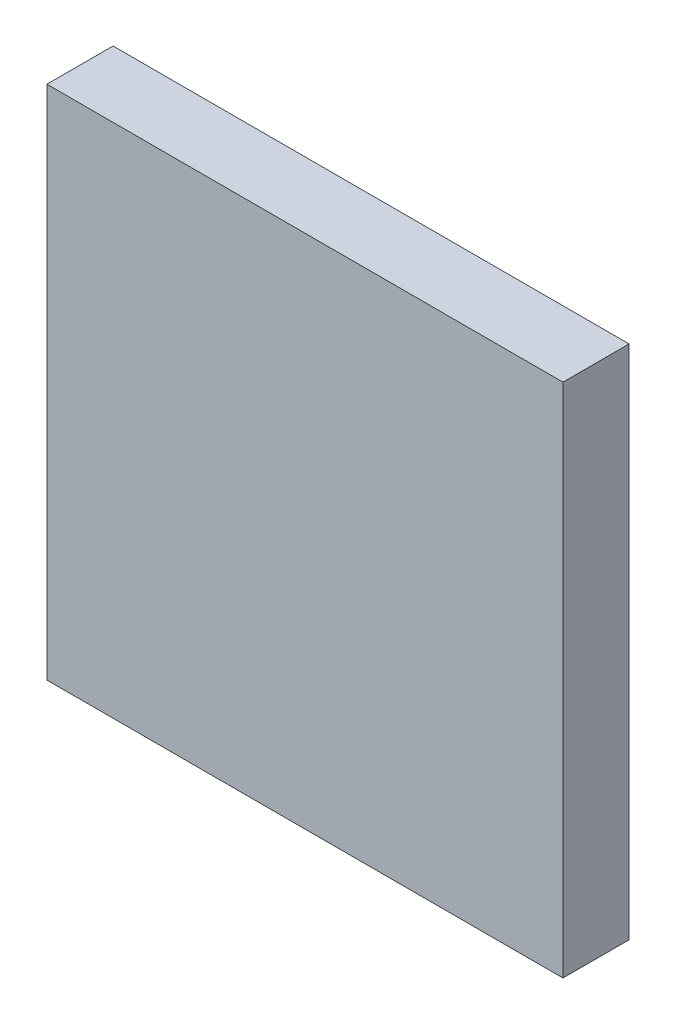
from build123d import *

# Parameters (mm, degrees)
SKETCH1_W           = 39
SKETCH1_H           = 39
BOSS_EXTRUDE1_DEPTH = 5


with BuildPart() as part:
    # Sketch1 → Boss-Extrude1 (new body)
    with BuildSketch(Plane.XY):
        with Locations((19.5, 19.5)):
            Rectangle(SKETCH1_W, SKETCH1_H)
    extrude(amount=BOSS_EXTRUDE1_DEPTH)


solid = part.part
